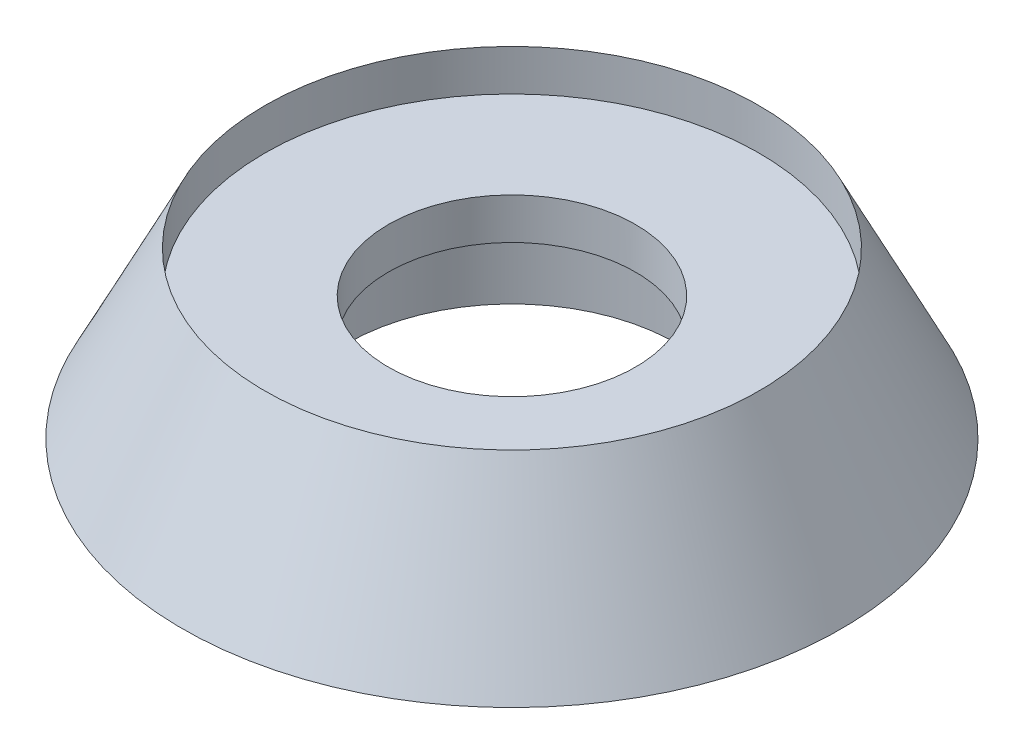
from build123d import *

# Parameters (mm, degrees)
CROQUIS3_R            = 30
CORTAR_EXTRUIR1_DEPTH = 5
CROQUIS4_R            = 15
CORTAR_EXTRUIR2_DEPTH = 59.523499554
CROQUIS5_R            = 20
CORTAR_EXTRUIR3_DEPTH = 10


with BuildPart() as part:
    # Croquis2 → Revolución1 (revolve)
    with BuildSketch(Plane.XY, mode=Mode.PRIVATE) as revoluci_n1_sk:
        Polygon((0, 0), (30, 0), (40, -20), (0, -20), align=None)
    revolve(revoluci_n1_sk.sketch.rotate(Axis((0, 0, 0), (0, -1, 0)), 180), axis=Axis((0, 0, 0), (0, -1, 0)))

    # Croquis3 → Cortar-Extruir1 (cut)
    with BuildSketch(Plane(origin=(0, 0, 0), x_dir=(1, 0, 0), z_dir=(0, 1, 0))):
        with Locations(Location((0, 0, 0), (0, 0, 180))):
            Circle(CROQUIS3_R)
    extrude(amount=-CORTAR_EXTRUIR1_DEPTH, mode=Mode.SUBTRACT)

    # Croquis4 → Cortar-Extruir2 (cut, through all)
    with BuildSketch(Plane(origin=(0, -5, 0), x_dir=(1, 0, 0), z_dir=(0, 1, 0))):
        with Locations(Location((0, 0, 0), (0, 0, 180))):
            Circle(CROQUIS4_R)
    extrude(amount=-CORTAR_EXTRUIR2_DEPTH, mode=Mode.SUBTRACT)

    # Croquis5 → Cortar-Extruir3 (cut)
    with BuildSketch(Plane.XZ.offset(20)):
        Circle(CROQUIS5_R)
    extrude(amount=-CORTAR_EXTRUIR3_DEPTH, mode=Mode.SUBTRACT)


solid = part.part
